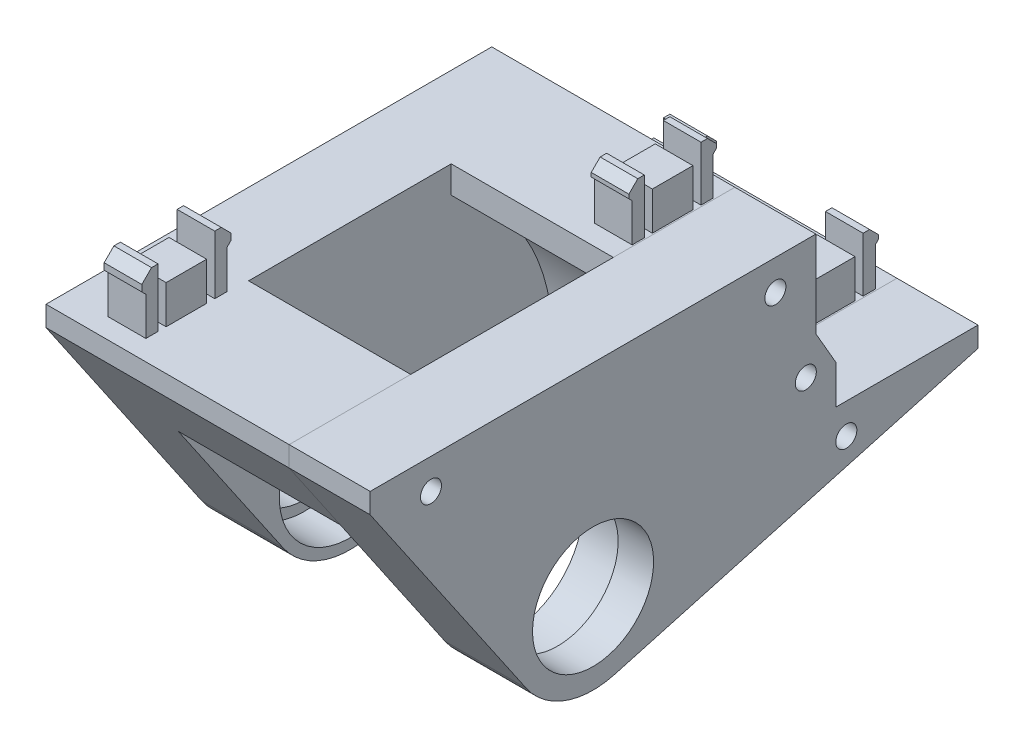
from build123d import *

# Parameters (mm, degrees)
BOSS_EXTRUDE4_DEPTH     = 25.4
CUT_EXTRUDE4_DEPTH      = 12.7
CUT_EXTRUDE5_DEPTH      = 32.55
CUT_EXTRUDE5_DEPTH_BACK = 7.15
SKETCH12_R              = 11.074999948
SKETCH13_R              = 9.487499948
CUT_EXTRUDE6_DEPTH      = 75.121121315
SKETCH22_W              = 5.899999884
SKETCH22_H              = 12.7
BOSS_EXTRUDE9_DEPTH     = 6
SKETCH23_W              = 5.899999884
SKETCH23_H              = 12.7
BOSS_EXTRUDE10_DEPTH    = 5.999999938
BOSS_EXTRUDE11_DEPTH    = 5.899999884
BOSS_EXTRUDE12_DEPTH    = 5.899999884
SKETCH26_W              = 1.27
SKETCH26_H              = 5.999999938
CUT_EXTRUDE10_DEPTH     = 71.856487821
SKETCH29_W              = 1.27
SKETCH29_H              = 6.35
SKETCH29_H_2            = 5.999999938
CUT_EXTRUDE11_DEPTH     = 71.856487821
SKETCH30_W              = 8.365060076
SKETCH30_H              = 18.797575461
SKETCH30_W_2            = 9.861886537
SKETCH30_H_2            = 15.225368687
CUT_EXTRUDE12_DEPTH     = 81.697482922
SPLIT1_SURFACE_1_BACK   = 121.536
SPLIT1_SURFACE_1_DEPTH  = 243.072
SPLIT1_SURFACE_2_BACK   = 121.536
SPLIT1_SURFACE_2_DEPTH  = 243.072
SKETCH33_R              = 1.650000002
CUT_EXTRUDE13_DEPTH     = 12.7


with BuildPart() as part:
    # Sketch10 → Boss-Extrude4 (new, symmetric)
    with BuildSketch(Plane(origin=(-22.225, 0, 0), x_dir=(0, 0, -1), z_dir=(1, 0, 0))):
        with BuildLine():
            Line((47.625, -5.999999938), (47.625, -9.174999938))
            Line((47.625, -9.174999938), (-9.311118837, -24.939505074))
            ThreePointArc((-9.311118837, -24.939505074), (-14.288949363, -25.300207932), (-19.021389685, -23.71499126))
            ThreePointArc((-19.021389685, -23.71499126), (-21.319677585, -22.026905078), (-23.18338697, -19.868584075))
            Line((-23.18338697, -19.868584075), (-47.625, 15.875))
            Line((-47.625, 15.875), (-47.625, 19.05))
            Line((-47.625, 19.05), (22.225, 19.05))
            Line((22.225, 19.05), (22.225, 5.499261314))
            Line((22.225, 5.499261314), (25.4, 0))
            Line((25.4, 0), (25.4, -5.999999938))
            Line((25.4, -5.999999938), (47.625, -5.999999938))
        make_face()
    extrude(amount=BOSS_EXTRUDE4_DEPTH, both=True)

    # Sketch11 → Cut-Extrude4 (cut, symmetric)
    with BuildSketch(Plane(origin=(-22.225, 0, 0), x_dir=(0, 0, -1), z_dir=(1, 0, 0))):
        with BuildLine():
            Line((3.175, 19.05), (3.175, 14.79630657))
            ThreePointArc((3.175, 14.79630657), (-12.7, -44.45), (-28.575, 14.79630657))
            Line((-28.575, 14.79630657), (-28.575, 19.05))
            Line((-28.575, 19.05), (3.175, 19.05))
        make_face()
    extrude(amount=CUT_EXTRUDE4_DEPTH, both=True, mode=Mode.SUBTRACT)

    # Sketch12 → Cut-Extrude5 (cut, two sides: drawn at the far end of the back side and taken through both)
    with BuildSketch(Plane.ZY.offset(9.525).offset(-CUT_EXTRUDE5_DEPTH_BACK)):
        with Locations(Location((12.7, -12.7, 0), (0, 0, 180))):
            Circle(SKETCH12_R)
    extrude(amount=CUT_EXTRUDE5_DEPTH + CUT_EXTRUDE5_DEPTH_BACK, mode=Mode.SUBTRACT)

    # Sketch13 → Cut-Extrude6 (cut, through all)
    with BuildSketch(Plane.ZY.offset(47.625)):
        with Locations((12.7, -12.7)):
            Circle(SKETCH13_R)
    extrude(amount=-CUT_EXTRUDE6_DEPTH, mode=Mode.SUBTRACT)

    # Sketch22 → Boss-Extrude9 (add)
    with BuildSketch(Plane(origin=(0, -5.999999938, 0), x_dir=(1, 0, 0), z_dir=(0, 1, 0))):
        with Locations((-38.1, 38.1)):
            Rectangle(SKETCH22_W, SKETCH22_H)
    boss_extrude9 = extrude(amount=BOSS_EXTRUDE9_DEPTH)

    # Sketch23 → Boss-Extrude10 (add)
    with BuildSketch(Plane(origin=(0, 19.05, 0), x_dir=(1, 0, 0), z_dir=(0, 1, 0))):
        with Locations((-38.1, -38.1)):
            Rectangle(SKETCH23_W, SKETCH23_H)
        with Locations((-38.1, 12.7)):
            Rectangle(SKETCH23_W, SKETCH23_H)
    boss_extrude10 = extrude(amount=BOSS_EXTRUDE10_DEPTH)

    # Sketch25 → Boss-Extrude11 (add)
    with BuildSketch(Plane.ZY.offset(41.049999942)):
        Polygon((-44.958, 0.508), (-44.45, 0), (-42.545, 0), (-42.545, 2.54), (-43.561, 2.54), (-44.958, 1.143), align=None)
        Polygon((-33.655, 2.54), (-33.655, 0), (-31.75, 0), (-31.242, 0.508), (-31.242, 1.143), (-32.639, 2.54), align=None)
    boss_extrude11 = extrude(amount=-BOSS_EXTRUDE11_DEPTH)

    # Sketch27 → Boss-Extrude12 (add)
    with BuildSketch(Plane.ZY.offset(41.049999942)):
        Polygon((-19.05, 25.049999938), (-17.145, 25.049999938), (-17.145, 27.589999938), (-18.161, 27.589999938), (-19.558, 26.192999938), (-19.558, 25.557999938), align=None)
        Polygon((-6.35, 25.049999938), (-8.255, 25.049999938), (-8.255, 27.589999938), (-7.239, 27.589999938), (-5.842, 26.192999938), (-5.842, 25.557999938), align=None)
        Polygon((31.75, 25.049999938), (33.655, 25.049999938), (33.655, 28.224999938), (32.639, 28.224999938), (31.115, 26.700999938), (31.115, 25.684999938), align=None)
        Polygon((44.45, 25.049999938), (42.545, 25.049999938), (42.545, 28.224999938), (43.561, 28.224999938), (45.085, 26.700999938), (45.085, 25.684999938), align=None)
    boss_extrude12 = extrude(amount=-BOSS_EXTRUDE12_DEPTH)

    # Sketch26 → Cut-Extrude10 (cut, through all)
    with BuildSketch(Plane.ZY.offset(41.049999942)):
        with Locations((-41.91, -2.999999969)):
            Rectangle(SKETCH26_W, SKETCH26_H)
        with Locations((-34.29, -2.999999969)):
            Rectangle(SKETCH26_W, SKETCH26_H)
    cut_extrude10 = extrude(amount=-CUT_EXTRUDE10_DEPTH, mode=Mode.SUBTRACT)

    # Sketch29 → Cut-Extrude11 (cut, through all)
    with BuildSketch(Plane.ZY.offset(41.049999942)):
        with Locations((-16.51, 22.225)):
            Rectangle(SKETCH29_W, SKETCH29_H)
        with Locations((-8.89, 22.225)):
            Rectangle(SKETCH29_W, SKETCH29_H)
        with Locations((34.29, 22.049999969)):
            Rectangle(SKETCH29_W, SKETCH29_H_2)
        with Locations((41.91, 22.049999969)):
            Rectangle(SKETCH29_W, SKETCH29_H_2)
    cut_extrude11 = extrude(amount=-CUT_EXTRUDE11_DEPTH, mode=Mode.SUBTRACT)

    # Mirror1: Boss-Extrude9, Boss-Extrude10, Boss-Extrude11, Boss-Extrude12, Cut-Extrude10, Cut-Extrude11 across plane
    add(boss_extrude9.mirror(Plane(origin=(-25.4, 0, 0), x_dir=(0, 0, 1), z_dir=(1, 0, 0))))
    add(boss_extrude10.mirror(Plane(origin=(-25.4, 0, 0), x_dir=(0, 0, 1), z_dir=(1, 0, 0))))
    add(boss_extrude11.mirror(Plane(origin=(-25.4, 0, 0), x_dir=(0, 0, 1), z_dir=(1, 0, 0))))
    add(boss_extrude12.mirror(Plane(origin=(-25.4, 0, 0), x_dir=(0, 0, 1), z_dir=(1, 0, 0))))
    add(cut_extrude10.mirror(Plane(origin=(-25.4, 0, 0), x_dir=(0, 0, 1), z_dir=(1, 0, 0))), mode=Mode.SUBTRACT)
    add(cut_extrude11.mirror(Plane(origin=(-25.4, 0, 0), x_dir=(0, 0, 1), z_dir=(1, 0, 0))), mode=Mode.SUBTRACT)

    # Sketch30 → Cut-Extrude12 (cut, through all)
    with BuildSketch(Plane(origin=(0, 19.05, 0), x_dir=(1, 0, 0), z_dir=(0, 1, 0))):
        with Locations((-12.803226035, -38.026550337)):
            Rectangle(SKETCH30_W, SKETCH30_H)
        with Locations((-37.969415348, 12.586881501)):
            Rectangle(SKETCH30_W_2, SKETCH30_H_2)
    extrude(amount=CUT_EXTRUDE12_DEPTH, mode=Mode.SUBTRACT)


with BuildPart() as body_2:
    # Split1: the piece behind the surface
    add(part.part)
    # Split1 surface: a surface, the sketch's curves swept straight by 243.072 mm
    with BuildLine(Plane(origin=(0, 19.05, 0), x_dir=(1, 0, 0), z_dir=(0, 1, 0)).offset(-SPLIT1_SURFACE_1_BACK), mode=Mode.PRIVATE) as split1_surface_1_path:
        Line((-9.525, -47.625), (-9.525, 48.920147687))
    split1_surface_1 = Shell.extrude(split1_surface_1_path.wire(), (0 * SPLIT1_SURFACE_1_DEPTH, 1 * SPLIT1_SURFACE_1_DEPTH, 0 * SPLIT1_SURFACE_1_DEPTH))
    split(bisect_by=split1_surface_1, keep=Keep.BOTTOM)


with BuildPart() as part_1:
    add(part.part)

    # Split1: split by a surface, the side it looks to stays
    # Split1 surface: a surface, the sketch's curves swept straight by 243.072 mm
    with BuildLine(Plane(origin=(0, 19.05, 0), x_dir=(1, 0, 0), z_dir=(0, 1, 0)).offset(-SPLIT1_SURFACE_2_BACK), mode=Mode.PRIVATE) as split1_surface_2_path:
        Line((-9.525, -47.625), (-9.525, 48.920147687))
    split1_surface_2 = Shell.extrude(split1_surface_2_path.wire(), (0 * SPLIT1_SURFACE_2_DEPTH, 1 * SPLIT1_SURFACE_2_DEPTH, 0 * SPLIT1_SURFACE_2_DEPTH))
    split(bisect_by=split1_surface_2, keep=Keep.TOP)


with BuildPart() as cut_extrude13_tool:
    # Sketch33 → Cut-Extrude13 (new, symmetric)
    with BuildSketch(Plane(origin=(-9.525, 0, 0), x_dir=(0, 0, -1), z_dir=(1, 0, 0))):
        with Locations((-38.1, 14.2875)):
            Circle(SKETCH33_R)
        with Locations((15.875, 14.2875)):
            Circle(SKETCH33_R)
        with Locations((20.6375, 0.350000062)):
            Circle(SKETCH33_R)
        with Locations((26.9875, -10.762499938)):
            Circle(SKETCH33_R)
    extrude(amount=CUT_EXTRUDE13_DEPTH, both=True)


with BuildPart() as part_2:
    add(part_1.part)

    # Cut-Extrude13: cut by cut_extrude13_tool
    add(cut_extrude13_tool.part, mode=Mode.SUBTRACT)


with BuildPart() as body_2_1:
    add(body_2.part)

    # Cut-Extrude13: cut by cut_extrude13_tool
    add(cut_extrude13_tool.part, mode=Mode.SUBTRACT)


solid = Compound([part_2.part, body_2_1.part])
